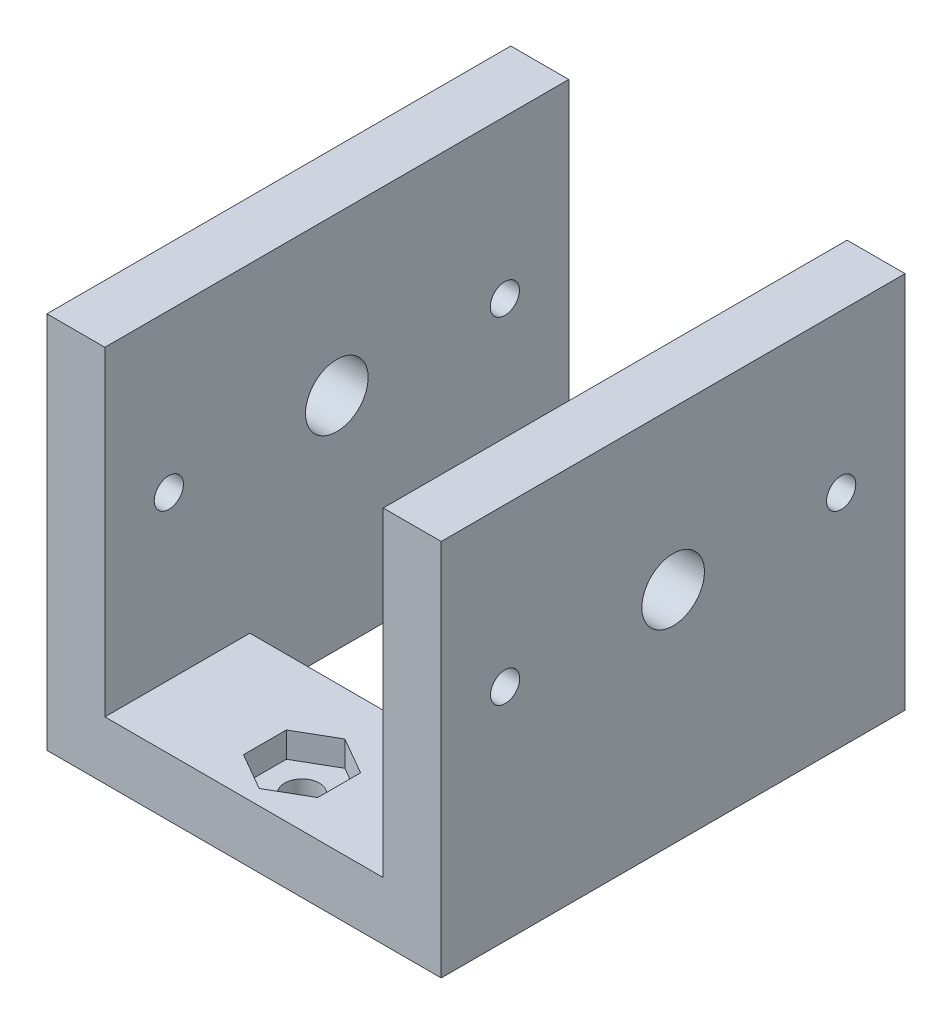
from build123d import *

# Parameters (mm, degrees)
BOSS_EXTRUDE1_DEPTH      = 12.7
BOSS_EXTRUDE1_DEPTH_BACK = 12.7
SKETCH1_R                = 4.445
SKETCH9_W                = 30.48
SKETCH9_H                = 35.052
CUT_EXTRUDE6_DEPTH       = 60.613097773
BOSS_EXTRUDE3_DEPTH      = 12.7
SKETCH11_W               = 5.350768363
SKETCH11_H               = 57.15
CUT_EXTRUDE7_DEPTH       = 75.08914513
SKETCH12_W               = 30.48
SKETCH12_H               = 19.05
CUT_EXTRUDE8_DEPTH       = 89.211973463
SKETCH14_R               = 1.6
CUT_EXTRUDE9_DEPTH       = 75.795998583
SKETCH15_R               = 3.429
CUT_EXTRUDE10_DEPTH      = 75.795998583
CUT_EXTRUDE11_DEPTH      = 2.778125
F_6_CLEARANCE_HOLE1_D    = 3.7973
SKETCH25_W               = 89.81357484
SKETCH25_H               = 39.457269438
CUT_EXTRUDE14_DEPTH      = 67.031594151


with BuildPart() as part:
    # Sketch1 → Boss-Extrude1 (new, two sides: drawn at the far end of the back side and taken through both)
    with BuildSketch(Plane.XY.offset(-BOSS_EXTRUDE1_DEPTH_BACK)):
        with BuildLine():
            Line((-26.940768363, -17.415768363), (-26.940768363, 39.734231637))
            Line((-26.940768363, 39.734231637), (26.940768363, 39.734231637))
            Line((26.940768363, 39.734231637), (26.940768363, -17.415768363))
            ThreePointArc((26.940768363, -17.415768363), (36.465768363, -26.940768363), (26.940768363, -36.465768363))
            Line((26.940768363, -36.465768363), (-26.940768363, -36.465768363))
            ThreePointArc((-26.940768363, -36.465768363), (-36.465768363, -26.940768363), (-26.940768363, -17.415768363))
        make_face()
        with Locations((-26.940768363, -26.940768363)):
            Circle(SKETCH1_R, mode=Mode.SUBTRACT)
        with Locations((26.940768363, -26.940768363)):
            Circle(SKETCH1_R, mode=Mode.SUBTRACT)
    extrude(amount=BOSS_EXTRUDE1_DEPTH + BOSS_EXTRUDE1_DEPTH_BACK)

    # Sketch9 → Cut-Extrude6 (cut, through all)
    with BuildSketch(Plane.XY.offset(12.7)):
        with Locations((0, 22.208231637)):
            Rectangle(SKETCH9_W, SKETCH9_H)
    extrude(amount=-CUT_EXTRUDE6_DEPTH, mode=Mode.SUBTRACT)

    # Sketch10 → Boss-Extrude3 (add)
    with BuildSketch(Plane.XY.offset(12.7)):
        Polygon((-26.940768363, 39.734231637), (-26.940768363, -1.667768363), (26.940768363, -1.667768363), (26.940768363, 39.734231637), (15.24, 39.734231637), (15.24, 4.682231637), (-15.24, 4.682231637), (-15.24, 39.734231637), align=None)
    boss_extrude3 = extrude(amount=BOSS_EXTRUDE3_DEPTH)

    # Mirror4: Boss-Extrude3 across plane
    add(boss_extrude3.mirror(Plane.XY))

    # Sketch11 → Cut-Extrude7 (cut, through all)
    with BuildSketch(Plane.XY.offset(25.4)):
        with Locations((-24.265384181, 11.159231637)):
            Rectangle(SKETCH11_W, SKETCH11_H)
    cut_extrude7 = extrude(amount=-CUT_EXTRUDE7_DEPTH, mode=Mode.SUBTRACT)

    # Mirror5: Cut-Extrude7 across plane
    add(cut_extrude7.mirror(Plane(origin=(0, 0, 0), x_dir=(0, 0, 1), z_dir=(1, 0, 0))), mode=Mode.SUBTRACT)

    # Sketch12 → Cut-Extrude8 (cut, through all)
    with BuildSketch(Plane.XZ.offset(36.465768363)):
        Rectangle(SKETCH12_W, SKETCH12_H)
    extrude(amount=-CUT_EXTRUDE8_DEPTH, mode=Mode.SUBTRACT)

    # Sketch14 → Cut-Extrude9 (cut, through all)
    with BuildSketch(Plane.ZY.offset(21.59)):
        with Locations((-18.4, 22.462231637)):
            Circle(SKETCH14_R)
    cut_extrude9 = extrude(amount=-CUT_EXTRUDE9_DEPTH, mode=Mode.SUBTRACT)

    # Mirror6: Cut-Extrude9 across plane
    add(cut_extrude9.mirror(Plane.XY), mode=Mode.SUBTRACT)

    # Sketch15 → Cut-Extrude10 (cut, through all)
    with BuildSketch(Plane(origin=(21.59, 0, 0), x_dir=(0, 0, -1), z_dir=(1, 0, 0))):
        with Locations((0, 22.462231637)):
            Circle(SKETCH15_R)
    extrude(amount=-CUT_EXTRUDE10_DEPTH, mode=Mode.SUBTRACT)

    # Sketch18 → Cut-Extrude11 (cut)
    with BuildSketch(Plane(origin=(0, 4.682231637, 0), x_dir=(1, 0, 0), z_dir=(0, 1, 0))):
        Polygon((4.064, 21.396351494), (0, 23.742702988), (-4.064, 21.396351494), (-4.064, 16.703648506), (0, 14.357297012), (4.064, 16.703648506), align=None)
    cut_extrude11 = extrude(amount=-CUT_EXTRUDE11_DEPTH, mode=Mode.SUBTRACT)

    # Mirror7: Cut-Extrude11 across plane
    add(cut_extrude11.mirror(Plane.XY), mode=Mode.SUBTRACT)

    # #6 Clearance Hole1 (through all)
    with Locations(Plane(origin=(0, 1.904106637, 0), x_dir=(1, 0, 0), z_dir=(0, 1, 0))):
        with Locations((0, 19.05)):
            f_6_clearance_hole1 = Hole(F_6_CLEARANCE_HOLE1_D / 2)

    # Mirror8: #6 Clearance Hole1 across plane
    add(f_6_clearance_hole1.mirror(Plane.XY), mode=Mode.SUBTRACT)

    # Sketch25 → Cut-Extrude14 (cut, through all)
    with BuildSketch(Plane(origin=(0, 0, -12.7), x_dir=(-1, 0, 0), z_dir=(0, 0, -1))):
        with Locations((0.758793643, -21.396403082)):
            Rectangle(SKETCH25_W, SKETCH25_H)
    extrude(amount=-CUT_EXTRUDE14_DEPTH, mode=Mode.SUBTRACT)


solid = part.part
